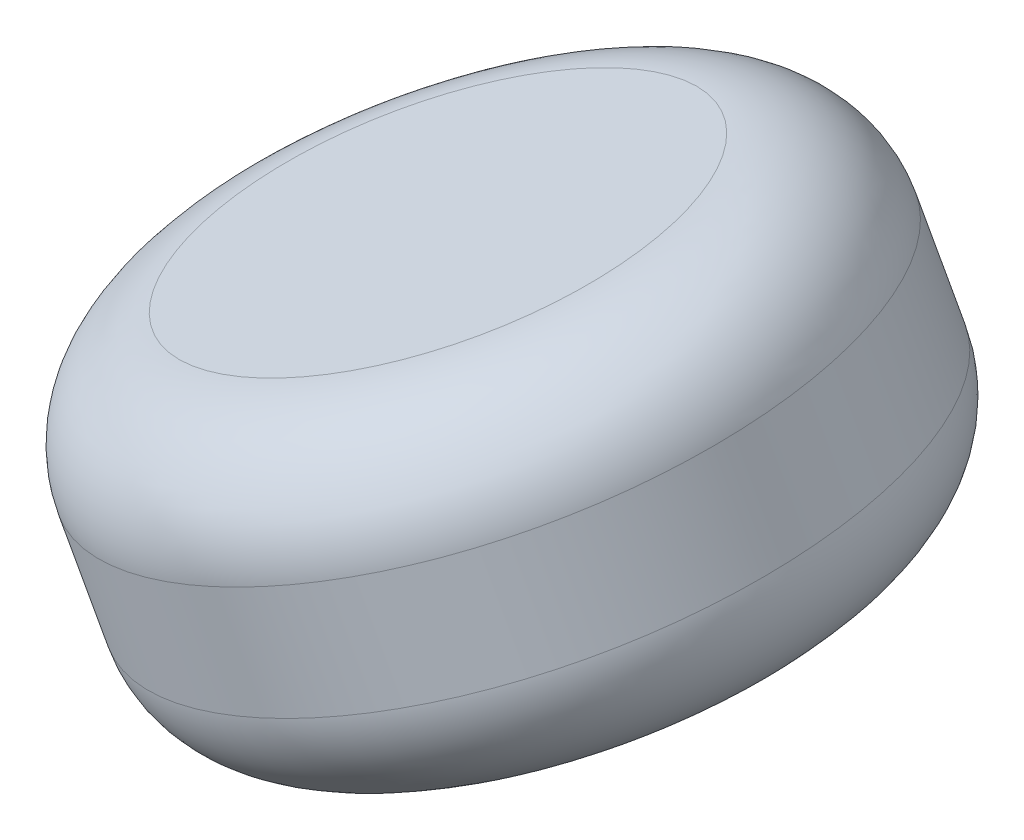
from build123d import *

# Parameters (mm, degrees)
SKETCH1_R           = 3
BOSS_EXTRUDE1_DEPTH = 3
FILLET2_R           = 1


with BuildPart() as part:
    # Sketch1 → Boss-Extrude1 (new body)
    with BuildSketch(Plane(origin=(-109.91658667, 289.262453813, 32.352156254), x_dir=(-0.7200369137388927, -0.19926247048571702, -0.6647114492088272), z_dir=(0.3532833096702826, -0.9297195277140368, -0.1039831856388323))):
        with Locations(Location((0, 0, 0), (0, 0, 138.061353095))):
            Circle(SKETCH1_R)
    extrude(amount=-BOSS_EXTRUDE1_DEPTH)

    # Fillet2
    fillet2_edges = [part.edges().sort_by_distance(p)[0] for p in [
        (-112.720947538, 288.196827181, 32.352156254),
        (-113.780797467, 290.985985764, 32.664105811),
    ]]
    fillet(fillet2_edges, radius=FILLET2_R)


solid = part.part
